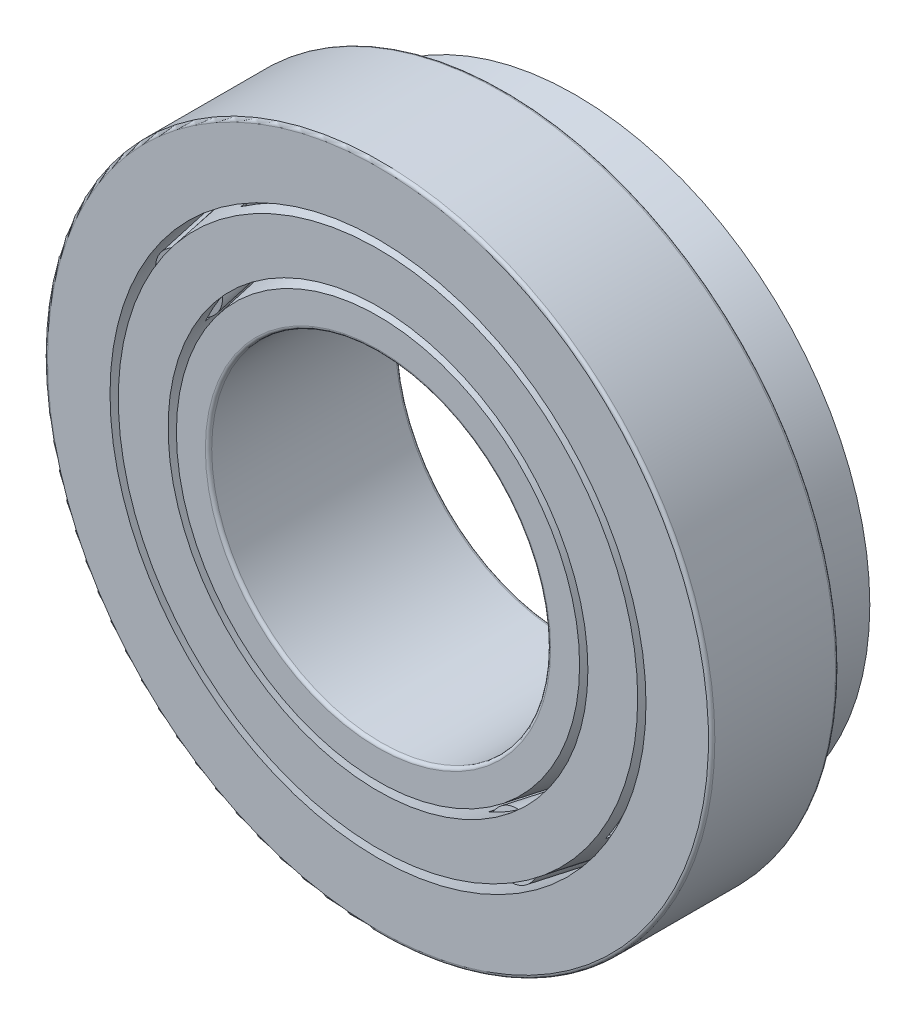
from build123d import *

# Parameters (mm, degrees)
CIRPATTERN1_COUNT = 12
CIRPATTERN2_COUNT = 12
FILLET1_R         = 0.238125
FILLET2_R         = 0.238125


with BuildPart() as part:
    # Sketch1 → Revolve1 (revolve)
    with BuildSketch(Plane(origin=(0, 0, 0), x_dir=(0, 0, -1), z_dir=(1, 0, 0))):
        Polygon((-7.12978, 25.00249), (2.39522, 25.00249), (2.39522, 21.761008491), (-7.12978, 20.081494), align=None)
    revolve(axis=Axis((0, 0, 7.12978), (0, 0, -1)))

    # Fillet1
    fillet1_edges = [part.edges().sort_by_distance(p)[0] for p in [
        (0, -25.00249, -2.39522),
        (0, -25.00249, 7.12978),
    ]]
    fillet(fillet1_edges, radius=FILLET1_R)


with BuildPart() as body_2:
    # Sketch5 → Revolve4 (revolve)
    with BuildSketch(Plane(origin=(0, 0, 0), x_dir=(0, 0, -1), z_dir=(1, 0, 0))):
        Polygon((7.12978, 17.620996), (-7.12978, 15.106650839), (-7.12978, 12.7), (7.12978, 12.7), align=None)
    revolve(axis=Axis((0, 0, 7.12978), (0, 0, -1)))

    # Fillet2
    fillet2_edges = [body_2.edges().sort_by_distance(p)[0] for p in [
        (0, -12.7, -7.12978),
        (0, -12.7, 7.12978),
    ]]
    fillet(fillet2_edges, radius=FILLET2_R)


with BuildPart() as body_3:
    # Sketch2 → Revolve2 (revolve)
    with BuildSketch(Plane(origin=(0, 0, 0), x_dir=(0, 0, -1), z_dir=(1, 0, 0))):
        Polygon((-7.12978, 19.459638605), (-7.12978, 15.728506234), (2.39522, 17.408020725), (8.293436464, 18.448035426), (7.65537525, 22.066660389), (2.39522, 21.139153096), align=None)
    revolve(axis=Axis((0, 0, 7.12978), (0, 0, -1)))

    # Sketch3 → Cut-Revolve1 (revolve, cut)
    with BuildSketch(Plane(origin=(0, 0, 0), x_dir=(0, 0, -1), z_dir=(1, 0, 0))):
        Polygon((-5.853657572, 17.819087234), (-6.279031715, 20.231503877), (1.969845857, 21.686003553), (2.39522, 19.273586911), align=None)
    cut_revolve1 = revolve(axis=Axis((0, 17.594072419, 7.12978), (0, 0.17364817766692758, -0.9848077530122086)), mode=Mode.SUBTRACT)

    # CirPattern1: Cut-Revolve1 ×12 about axis
    cirpattern1_axis = Axis((0, 0, -7.12978), (0, 0, 1))
    for i in range(1, CIRPATTERN1_COUNT):
        add(cut_revolve1.rotate(cirpattern1_axis, i * 360 / CIRPATTERN1_COUNT), mode=Mode.SUBTRACT)


with BuildPart() as body_4:
    # Sketch4 → Revolve3 (revolve)
    with BuildSketch(Plane(origin=(0, 0, 0), x_dir=(0, 0, -1), z_dir=(1, 0, 0))):
        Polygon((-6.234925077, 19.981362707), (2.013952494, 21.435862384), (2.39522, 19.273586911), (-5.853657572, 17.819087234), align=None)
    revolve(axis=Axis((0, 17.594072419, 7.12978), (0, 0.17364817766692758, -0.9848077530122086)))


with BuildPart() as cirpattern2_1:
    # CirPattern2: pattern copy
    add(body_4.part.rotate(Axis((0, 0, -7.12978), (0, 0, 1)), 1 * 360 / CIRPATTERN2_COUNT))


with BuildPart() as cirpattern2_2:
    # CirPattern2: pattern copy
    add(body_4.part.rotate(Axis((0, 0, -7.12978), (0, 0, 1)), 2 * 360 / CIRPATTERN2_COUNT))


with BuildPart() as cirpattern2_3:
    # CirPattern2: pattern copy
    add(body_4.part.rotate(Axis((0, 0, -7.12978), (0, 0, 1)), 3 * 360 / CIRPATTERN2_COUNT))


with BuildPart() as cirpattern2_4:
    # CirPattern2: pattern copy
    add(body_4.part.rotate(Axis((0, 0, -7.12978), (0, 0, 1)), 4 * 360 / CIRPATTERN2_COUNT))


with BuildPart() as cirpattern2_5:
    # CirPattern2: pattern copy
    add(body_4.part.rotate(Axis((0, 0, -7.12978), (0, 0, 1)), 5 * 360 / CIRPATTERN2_COUNT))


with BuildPart() as cirpattern2_6:
    # CirPattern2: pattern copy
    add(body_4.part.rotate(Axis((0, 0, -7.12978), (0, 0, 1)), 6 * 360 / CIRPATTERN2_COUNT))


with BuildPart() as cirpattern2_7:
    # CirPattern2: pattern copy
    add(body_4.part.rotate(Axis((0, 0, -7.12978), (0, 0, 1)), 7 * 360 / CIRPATTERN2_COUNT))


with BuildPart() as cirpattern2_8:
    # CirPattern2: pattern copy
    add(body_4.part.rotate(Axis((0, 0, -7.12978), (0, 0, 1)), 8 * 360 / CIRPATTERN2_COUNT))


with BuildPart() as cirpattern2_9:
    # CirPattern2: pattern copy
    add(body_4.part.rotate(Axis((0, 0, -7.12978), (0, 0, 1)), 9 * 360 / CIRPATTERN2_COUNT))


with BuildPart() as cirpattern2_10:
    # CirPattern2: pattern copy
    add(body_4.part.rotate(Axis((0, 0, -7.12978), (0, 0, 1)), 10 * 360 / CIRPATTERN2_COUNT))


with BuildPart() as cirpattern2_11:
    # CirPattern2: pattern copy
    add(body_4.part.rotate(Axis((0, 0, -7.12978), (0, 0, 1)), 11 * 360 / CIRPATTERN2_COUNT))


solid = Compound([part.part, body_2.part, body_3.part, body_4.part, cirpattern2_1.part, cirpattern2_2.part, cirpattern2_3.part, cirpattern2_4.part, cirpattern2_5.part, cirpattern2_6.part, cirpattern2_7.part, cirpattern2_8.part, cirpattern2_9.part, cirpattern2_10.part, cirpattern2_11.part])
